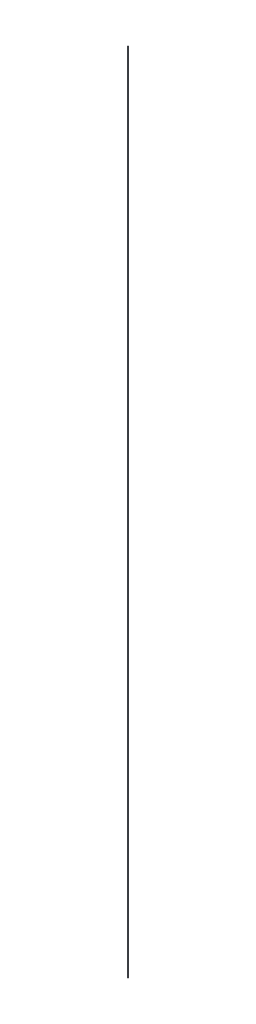
from build123d import *

# Parameters (mm, degrees)
SKETCH5_W           = 10
SKETCH5_H           = 29622.550185354
EXTRUDE_THIN1_DEPTH = 10


with BuildPart() as part:
    # Sketch5 → Extrude-Thin1 (new body)
    with BuildSketch(Plane(origin=(0, 0, 0), x_dir=(0, 0, -1), z_dir=(1, 0, 0))):
        with Locations((-7826.25184027, -68.3220256)):
            Rectangle(SKETCH5_W, SKETCH5_H)
    extrude(amount=EXTRUDE_THIN1_DEPTH)


solid = part.part
